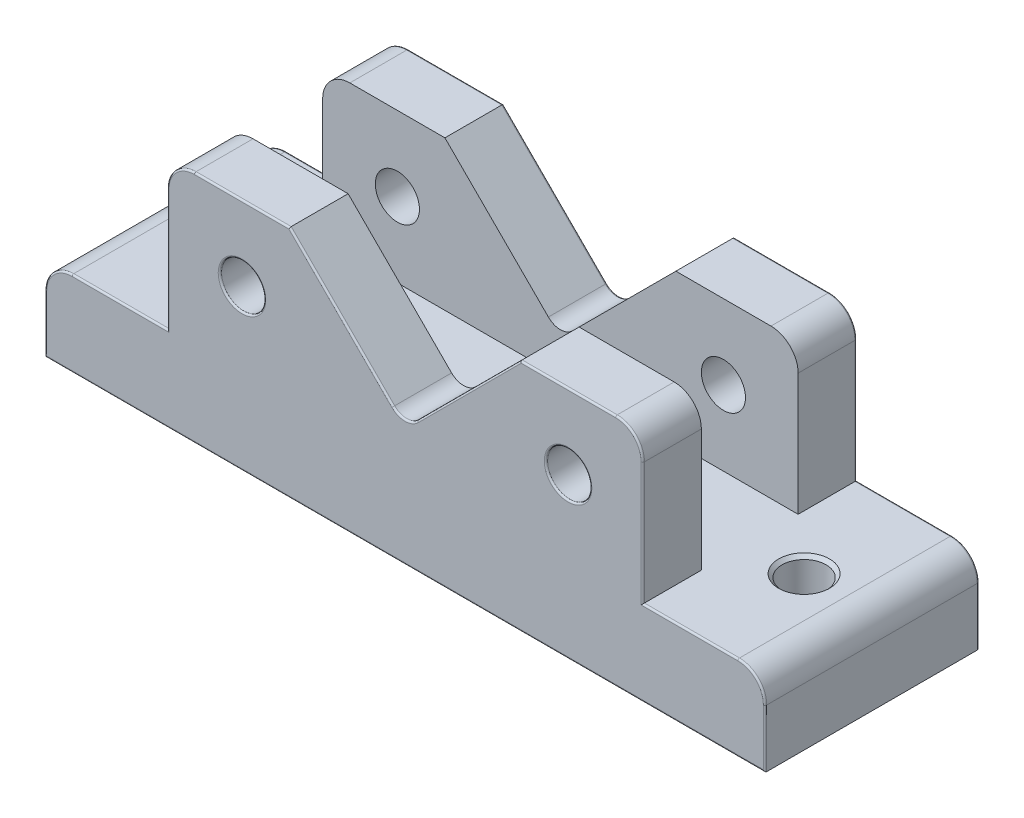
from build123d import *

# Parameters (mm, degrees)
BOSS_EXTRUDE1_DEPTH = 31.5
CUT_EXTRUDE1_REACH  = 193.649
SKETCH2_W           = 28.5
SKETCH2_H           = 44
SKETCH3_R           = 6.5
CUT_EXTRUDE2_DEPTH  = 232.676498592
SKETCH4_R           = 6.5
CUT_EXTRUDE3_DEPTH  = 219.797280605
FILLET1_R           = 0.5
CHAMFER1_SIZE       = 1


with BuildPart() as part:
    # Sketch1 → Boss-Extrude1 (new, symmetric)
    with BuildSketch(Plane.XY):
        with BuildLine():
            Line((0, 0), (212, 0))
            Line((212, 0), (212, 17))
            ThreePointArc((212, 17), (209.656854249, 22.656854249), (204, 25))
            Line((204, 25), (176, 25))
            Line((176, 25), (176, 61))
            ThreePointArc((176, 61), (173.656854249, 66.656854249), (168, 69))
            Line((168, 69), (140, 69))
            Line((140, 69), (109.535533906, 38.535533906))
            ThreePointArc((109.535533906, 38.535533906), (106, 37.071067812), (102.464466094, 38.535533906))
            Line((102.464466094, 38.535533906), (72, 69))
            Line((72, 69), (44, 69))
            ThreePointArc((44, 69), (38.343145751, 66.656854249), (36, 61))
            Line((36, 61), (36, 25))
            Line((36, 25), (8, 25))
            ThreePointArc((8, 25), (2.343145751, 22.656854249), (0, 17))
            Line((0, 17), (0, 0))
        make_face()
    extrude(amount=BOSS_EXTRUDE1_DEPTH, both=True)

    # Cut-Extrude1: up to this face of the body (flat: up to its plane)
    cut_extrude1_end = Plane(part.part.faces().sort_by_distance((36, 43, 0))[0])
    # Sketch2 → Cut-Extrude1 (cut, up to the picked face)
    with BuildSketch(Plane(origin=(176, 0, 0), x_dir=(0, 0, -1), z_dir=(1, 0, 0)), mode=Mode.PRIVATE) as cut_extrude1_sk1:
        with Locations((0, 47)):
            Rectangle(SKETCH2_W, SKETCH2_H)
    cut_extrude1_tool1 = split(extrude(cut_extrude1_sk1.sketch, amount=-CUT_EXTRUDE1_REACH, mode=Mode.PRIVATE), bisect_by=cut_extrude1_end, keep=Keep.BOTH, mode=Mode.PRIVATE)
    add(cut_extrude1_tool1.solids().sort_by(Axis((176, 47, 0), (-1, 0, 0)))[0], mode=Mode.SUBTRACT)

    # Sketch3 → Cut-Extrude2 (cut, through all)
    with BuildSketch(Plane.XY.offset(31.5)):
        with Locations((58, 47)):
            Circle(SKETCH3_R)
        with Locations(Location((154, 47, 0), (0, 0, 180))):
            Circle(SKETCH3_R)
    extrude(amount=-CUT_EXTRUDE2_DEPTH, mode=Mode.SUBTRACT)

    # Sketch4 → Cut-Extrude3 (cut, through all)
    with BuildSketch(Plane(origin=(0, 25, 0), x_dir=(1, 0, 0), z_dir=(0, 1, 0))):
        with Locations(Location((20, 0, 0), (0, 0, 270))):
            Circle(SKETCH4_R)
        with Locations(Location((192, 0, 0), (0, 0, 270))):
            Circle(SKETCH4_R)
    extrude(amount=-CUT_EXTRUDE3_DEPTH, mode=Mode.SUBTRACT)

    # Fillet1
    fillet1_edges = [part.edges().sort_by_distance(p)[0] for p in [
        (212, 8.5, 31.5),
        (2.343145751, 22.656854249, -31.5),
        (22, 25, -31.5),
        (36, 43, -31.5),
        (209.656854249, 22.656854249, 31.5),
        (38.343145751, 66.656854249, -31.5),
        (58, 69, -31.5),
        (87.232233047, 53.767766953, -31.5),
        (106, 37.071067812, -31.5),
        (124.767766953, 53.767766953, -31.5),
        (154, 69, -31.5),
        (173.656854249, 66.656854249, -31.5),
        (176, 43, -31.5),
        (190, 25, -31.5),
        (209.656854249, 22.656854249, -31.5),
        (190, 25, 31.5),
        (212, 8.5, -31.5),
        (106, 0, -31.5),
        (0, 8.5, -31.5),
        (176, 43, 31.5),
        (173.656854249, 66.656854249, 31.5),
        (154, 69, 31.5),
        (124.767766953, 53.767766953, 31.5),
        (106, 37.071067812, 31.5),
        (87.232233047, 53.767766953, 31.5),
        (58, 69, 31.5),
        (0, 8.5, 31.5),
        (38.343145751, 66.656854249, 31.5),
        (36, 43, 31.5),
        (22, 25, 31.5),
        (2.343145751, 22.656854249, 31.5),
        (51.5, 47, -31.5),
        (106, 0, 31.5),
        (51.5, 47, 31.5),
        (160.5, 47, -31.5),
        (160.5, 47, 31.5),
    ]]
    fillet(fillet1_edges, radius=FILLET1_R)

    # Chamfer1
    chamfer1_edges = [part.edges().sort_by_distance(p)[0] for p in [
        (20, 25, -6.5),
        (192, 25, -6.5),
    ]]
    chamfer(chamfer1_edges, length=CHAMFER1_SIZE)


solid = part.part
